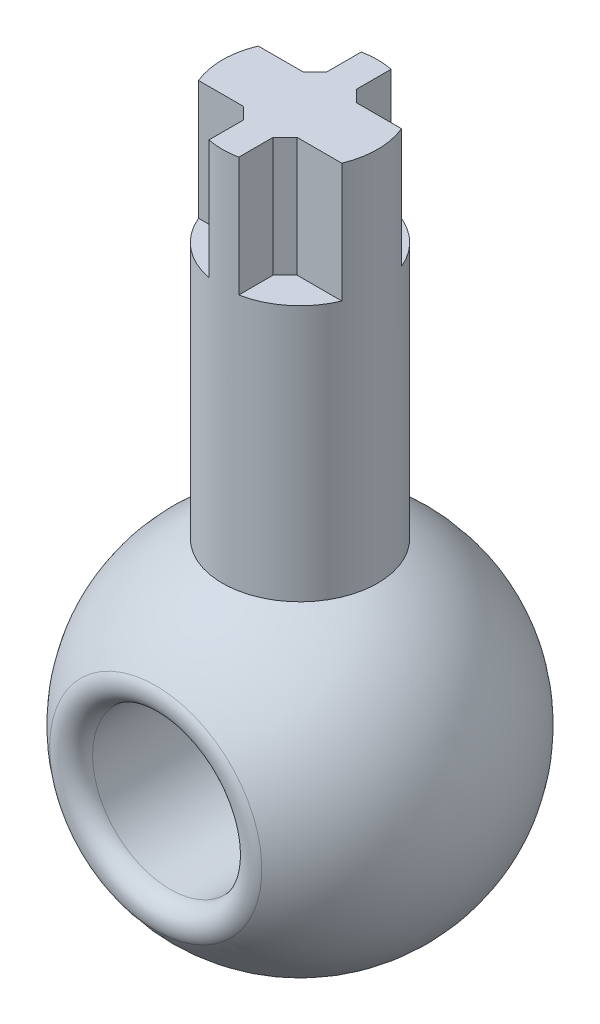
from build123d import *

# Parameters (mm, degrees)
SKETCH_S2_R              = 6.5
EXTRUDE_2_DEPTH          = 45
CUT_EXTRUDE_START        = -10
CUT_EXTRUDE_3_DEPTH      = 10
CHAMFER_4_SIZE           = 1
CUT_EXTRUDE_5_DEPTH      = 50.749371946
CUT_EXTRUDE_5_DEPTH_BACK = 50.749371946
SKETCH_S5_R              = 6.5
FILLET1_R                = 1.5


with BuildPart() as part:
    # Sketch s1 → Revolve 1 (revolve)
    with BuildSketch(Plane.XY):
        with BuildLine():
            Line((-15, 0), (15, 0))
            ThreePointArc((15, 0), (0, 15), (-15, 0))
        make_face()
    revolve(axis=Axis((-56.6721202, 0, 0), (1, 0, 0)))

    # Sketch s2 → Extrude 2 (add)
    with BuildSketch(Plane(origin=(0, 0, 0), x_dir=(1, 0, 0), z_dir=(0, 1, 0))):
        with Locations(Location((0, 0, 0), (0, 0, 90))):
            Circle(SKETCH_S2_R)
    extrude(amount=EXTRUDE_2_DEPTH)

    # Sketch s3 → Cut-Extrude 3 (cut)
    with BuildSketch(Plane(origin=(0, 45, 0), x_dir=(-1, 0, 0), z_dir=(0, 1, 0)).offset(CUT_EXTRUDE_START)):
        with BuildLine():
            Line((-1.25, -6.378675411), (-1.25, -2.5))
            Line((-1.25, -2.5), (-6, -2.5))
            ThreePointArc((-6, -2.5), (-4.111162334, -5.034713921), (-1.25, -6.378675411))
        make_face()
        with BuildLine():
            Line((1.25, -6.378675411), (1.25, -2.5))
            Line((1.25, -2.5), (6, -2.5))
            ThreePointArc((6, -2.5), (4.111162334, -5.034713921), (1.25, -6.378675411))
        make_face()
        with BuildLine():
            Line((-6, 2.5), (-1.25, 2.5))
            Line((-1.25, 2.5), (-1.25, 6.378675411))
            ThreePointArc((-1.25, 6.378675411), (-4.111162334, 5.034713921), (-6, 2.5))
        make_face()
        with BuildLine():
            Line((1.25, 2.5), (1.25, 6.378675411))
            ThreePointArc((1.25, 6.378675411), (4.111162334, 5.034713921), (6, 2.5))
            Line((6, 2.5), (1.25, 2.5))
        make_face()
    extrude(amount=CUT_EXTRUDE_3_DEPTH, mode=Mode.SUBTRACT)

    # Chamfer 4
    chamfer_4_edges = [part.edges().sort_by_distance(p)[0] for p in [
        (-1.25, 40, -2.5),
        (1.25, 40, 2.5),
        (1.25, 40, -2.5),
        (-1.25, 40, 2.5),
    ]]
    chamfer(chamfer_4_edges, length=CHAMFER_4_SIZE)

    # Sketch s5 → Cut-Extrude 5 (cut, two sides: drawn at the far end of the back side and taken through both)
    with BuildSketch(Plane.XY.offset(-CUT_EXTRUDE_5_DEPTH_BACK)):
        Circle(SKETCH_S5_R)
    extrude(amount=CUT_EXTRUDE_5_DEPTH + CUT_EXTRUDE_5_DEPTH_BACK, mode=Mode.SUBTRACT)

    # Fillet1
    fillet1_edges = [part.edges().sort_by_distance(p)[0] for p in [
        (-6.5, 0, -13.518505835),
        (-6.5, 0, 13.518505835),
    ]]
    fillet(fillet1_edges, radius=FILLET1_R)


solid = part.part
